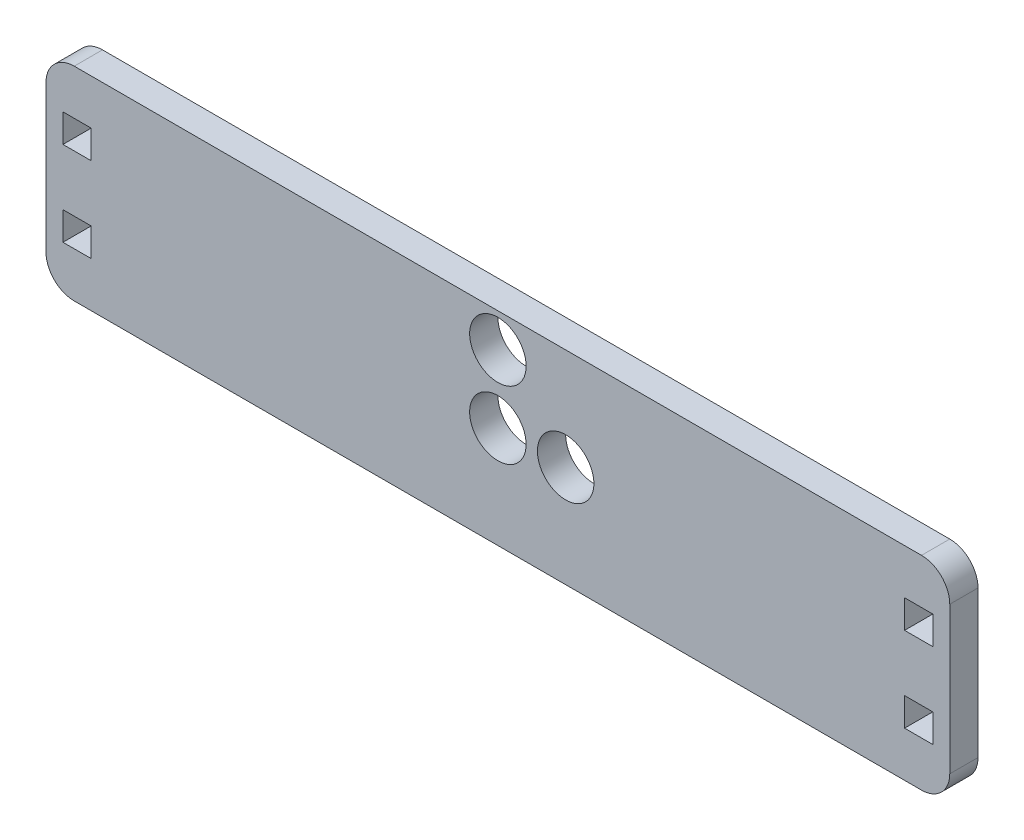
from build123d import *

# Parameters (mm, degrees)
ESQUISSE1_W        = 160
ESQUISSE1_H        = 36
ESQUISSE1_R        = 5
ESQUISSE1_W_2      = 5
ESQUISSE1_H_2      = 5
BOSS_EXTRU_1_DEPTH = 5
CONG_1_R           = 5


with BuildPart() as part:
    # Esquisse1 → Boss.-Extru.1 (new body)
    with BuildSketch(Plane.XY):
        Rectangle(ESQUISSE1_W, ESQUISSE1_H)
        Circle(ESQUISSE1_R, mode=Mode.SUBTRACT)
        with Locations((12, 0)):
            Circle(ESQUISSE1_R, mode=Mode.SUBTRACT)
        with Locations((0, 12)):
            Circle(ESQUISSE1_R, mode=Mode.SUBTRACT)
        with Locations((74.5, 7.5)):
            Rectangle(ESQUISSE1_W_2, ESQUISSE1_H_2, mode=Mode.SUBTRACT)
        with Locations((74.5, -7.5)):
            Rectangle(ESQUISSE1_W_2, ESQUISSE1_H_2, mode=Mode.SUBTRACT)
        with Locations((-74.5, 7.5)):
            Rectangle(ESQUISSE1_W_2, ESQUISSE1_H_2, mode=Mode.SUBTRACT)
        with Locations((-74.5, -7.5)):
            Rectangle(ESQUISSE1_W_2, ESQUISSE1_H_2, mode=Mode.SUBTRACT)
    extrude(amount=BOSS_EXTRU_1_DEPTH)

    # Congé1
    cong_1_edges = [part.edges().sort_by_distance(p)[0] for p in [
        (-80, 18, 2.5),
        (80, 18, 2.5),
        (80, -18, 2.5),
        (-80, -18, 2.5),
    ]]
    fillet(cong_1_edges, radius=CONG_1_R)


solid = part.part
